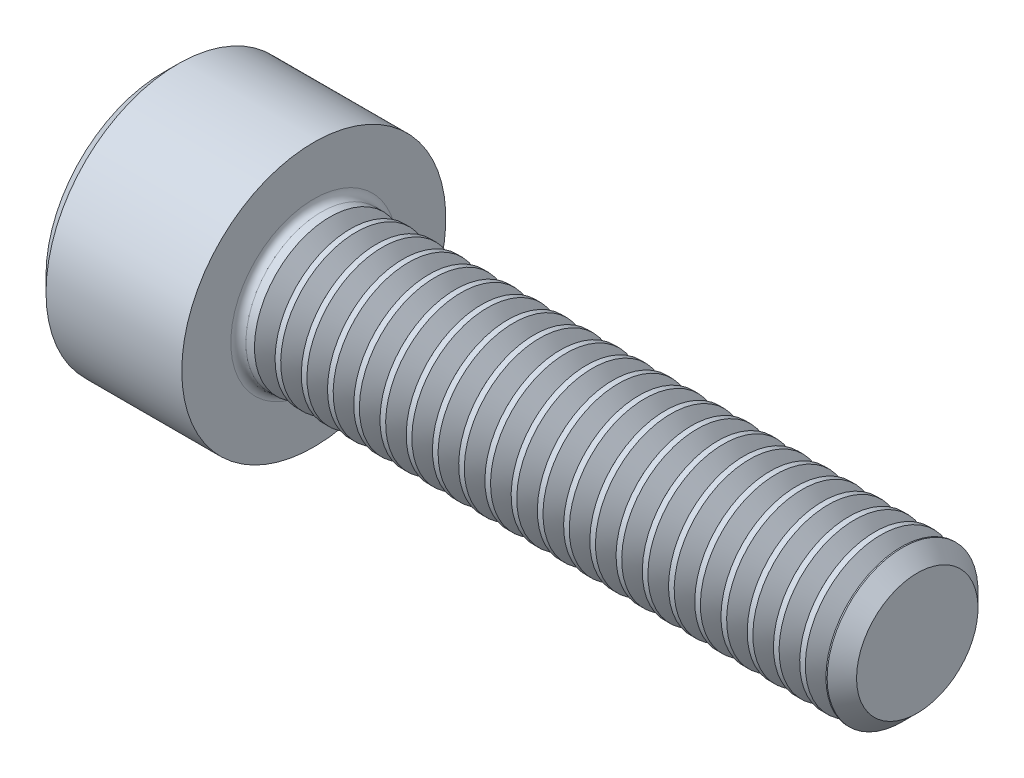
from build123d import *

# Parameters (mm, degrees)
FILLET1_R       = 0.2
HEX_2_DEPTH     = 2
THDSCHPAT_COUNT = 22
THDSCHPAT_PITCH = 0.695454545


with BuildPart() as part:
    # BodySke → Base-Revolve (revolve)
    with BuildSketch(Plane.XY, mode=Mode.PRIVATE) as base_revolve_sk:
        Polygon((0, 0), (0, 3.1), (0.4, 3.5), (4, 3.5), (4, 2), (19.61, 2), (20, 1.61), (20, 0), align=None)
    revolve(base_revolve_sk.sketch.rotate(Axis((-31.75, 0, 0), (1, 0, 0)), 90), axis=Axis((-31.75, 0, 0), (1, 0, 0)))

    # Fillet1
    fillet1_edges = [part.edges().sort_by_distance(p)[0] for p in [
        (4, 0, -2),
    ]]
    fillet(fillet1_edges, radius=FILLET1_R)

    # Sketch2 → Hex-PreBroach (revolve, cut)
    with BuildSketch(Plane.XY, mode=Mode.PRIVATE) as hex_prebroach_sk:
        Polygon((0, 1.5355), (2, 1.5355), (2.886521338, 0), (0, 0), align=None)
    revolve(hex_prebroach_sk.sketch.rotate(Axis((0, 0, 0), (1, 0, 0)), 90), axis=Axis((0, 0, 0), (1, 0, 0)), mode=Mode.SUBTRACT)

    # Sketch3 → Hex 2 (cut)
    with BuildSketch(Plane(origin=(0, 0, 0), x_dir=(0, 0.500000000000001, 0.866025403784438), z_dir=(-1, 0, 0))):
        Polygon((0.886521338, 1.5355), (-0.886521338, 1.5355), (-1.773042677, 0), (-0.886521338, -1.5355), (0.886521338, -1.5355), (1.773042677, 0), align=None)
    extrude(amount=-HEX_2_DEPTH, mode=Mode.SUBTRACT)

    # ThdSchSke → ThreadSchematic (revolve, cut)
    with BuildSketch(Plane.XY):
        Polygon((4.7, -1.61), (4.42691906, -2), (4.42691906, -2.5), (4.97308094, -2.5), (4.97308094, -2), align=None)
    threadschematic = revolve(axis=Axis((-3.175, 0, 0), (1, 0, 0)), mode=Mode.SUBTRACT)

    # ThdSchPat: ThreadSchematic ×22
    with Locations(*[(i * THDSCHPAT_PITCH, 0, 0) for i in range(1, THDSCHPAT_COUNT)]):
        add(threadschematic, mode=Mode.SUBTRACT)


solid = part.part
